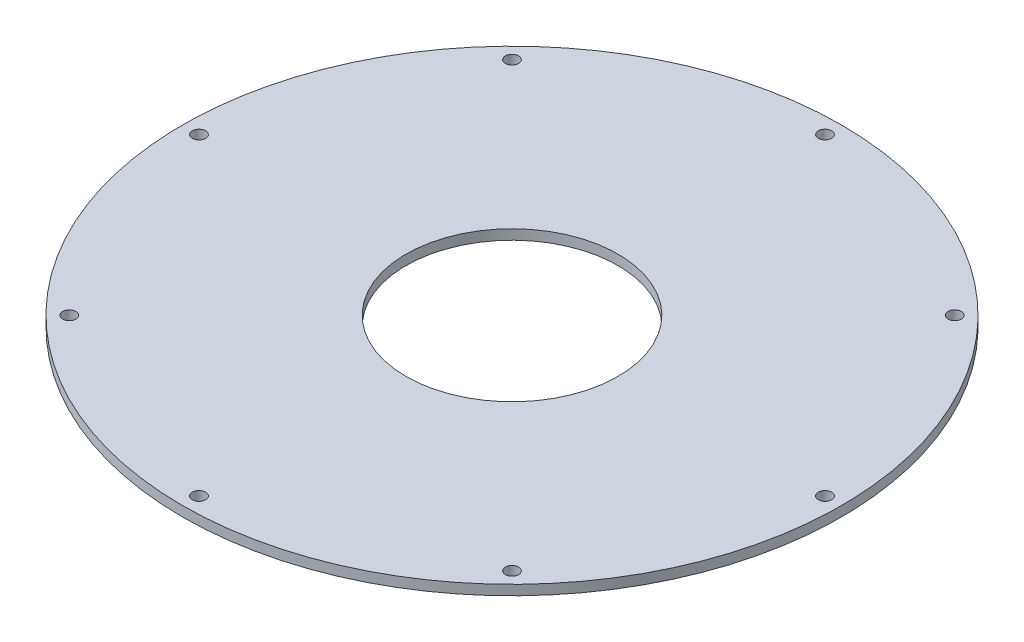
from build123d import *

# Parameters (mm, degrees)
SKETCH1_R                     = 99.5
SKETCH1_R_2                   = 32
BASE_DEPTH                    = 1.5
SKETCH2_R                     = 2
STRUCTURAL_HOLE_DEPTH         = 141.746225527
STRUCTURAL_HOLE_PATTERN_COUNT = 8


with BuildPart() as part:
    # Sketch1 → Base (new, symmetric)
    with BuildSketch(Plane(origin=(0, 0, 0), x_dir=(1, 0, 0), z_dir=(0, 1, 0))):
        with Locations(Location((0, 0, 0), (0, 0, 270))):
            Circle(SKETCH1_R)
        with Locations(Location((0, 0, 0), (0, 0, 270))):
            Circle(SKETCH1_R_2, mode=Mode.SUBTRACT)
    extrude(amount=BASE_DEPTH, both=True)

    # Sketch2 → Structural Hole (cut, through all)
    with BuildSketch(Plane(origin=(0, 1.5, 0), x_dir=(1, 0, 0), z_dir=(0, 1, 0))):
        with Locations(Location((0, 94.5, 0), (0, 0, 270))):
            Circle(SKETCH2_R)
    structural_hole = extrude(amount=-STRUCTURAL_HOLE_DEPTH, mode=Mode.SUBTRACT)

    # Structural Hole Pattern: Structural Hole ×8 about axis
    structural_hole_pattern_axis = Axis((0, 0, 0), (0, 1, 0))
    for i in range(1, STRUCTURAL_HOLE_PATTERN_COUNT):
        add(structural_hole.rotate(structural_hole_pattern_axis, i * 360 / STRUCTURAL_HOLE_PATTERN_COUNT), mode=Mode.SUBTRACT)


solid = part.part
